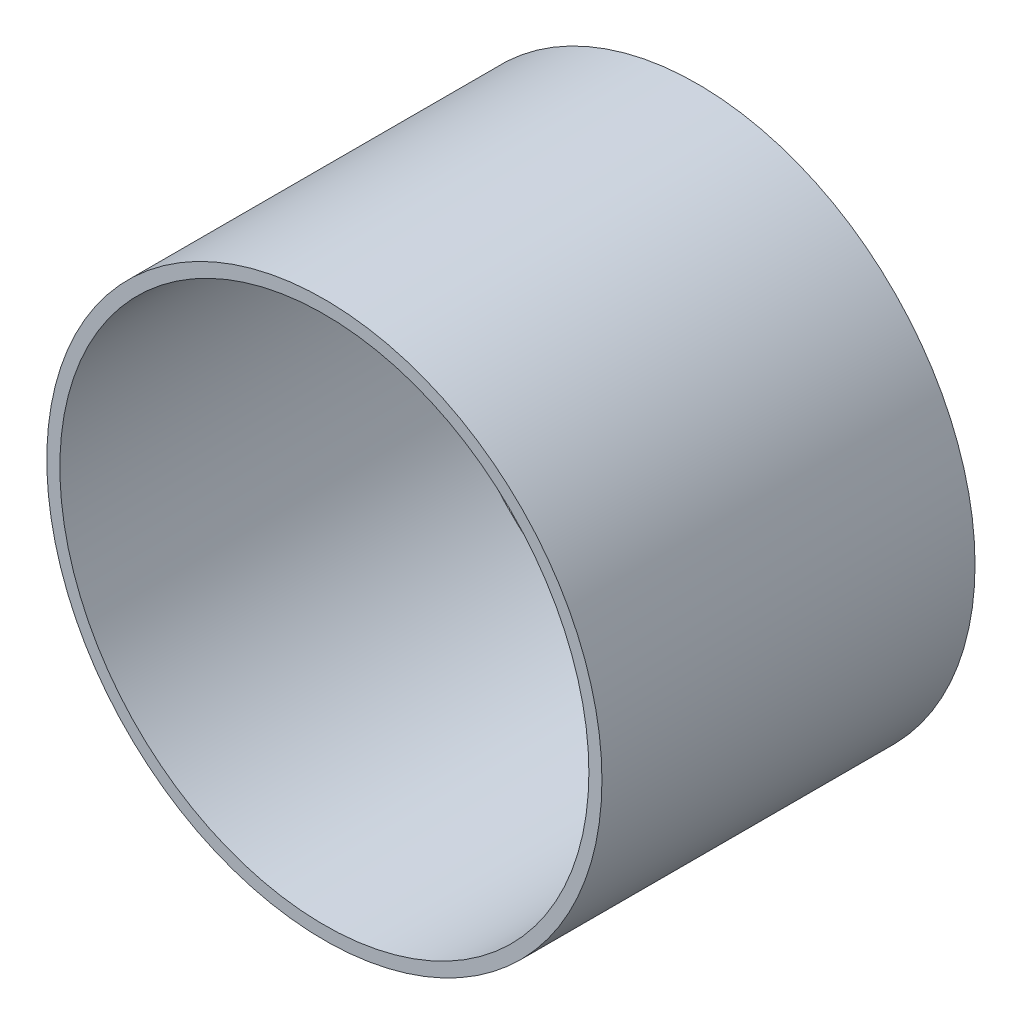
from build123d import *

# Parameters (mm, degrees)
SKETCH4_W = 50.8
SKETCH4_H = 1.778


with BuildPart() as part:
    # Sketch4 → Revolve1 (revolve)
    with BuildSketch(Plane(origin=(0, 0, 0), x_dir=(0, 0, -1), z_dir=(1, 0, 0)), mode=Mode.PRIVATE) as revolve1_sk:
        with Locations((25.4, 36.9062)):
            Rectangle(SKETCH4_W, SKETCH4_H)
    revolve(revolve1_sk.sketch.rotate(Axis((0, 0, 0), (0, 0, -1)), 90), axis=Axis((0, 0, 0), (0, 0, -1)))


solid = part.part
